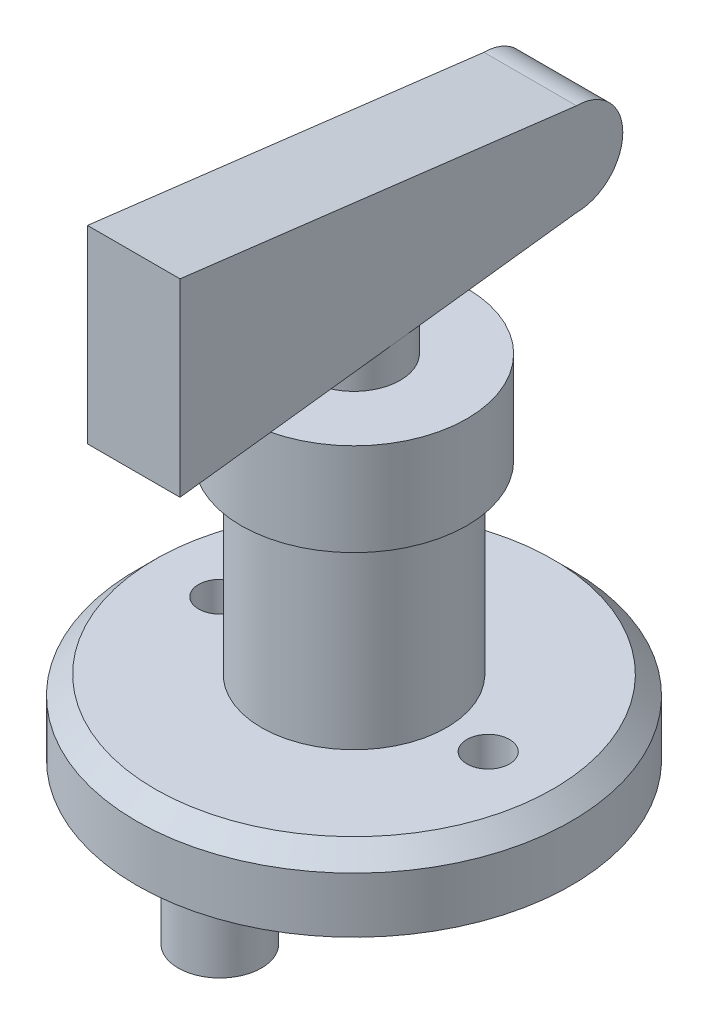
from build123d import *

# Parameters (mm, degrees)
SKETCH2_R           = 29.845
BOSS_EXTRUDE1_DEPTH = 10.16
SKETCH1_R           = 5.715
BOSS_EXTRUDE2_DEPTH = 12.7
SKETCH1_3_R         = 2.921
CUT_EXTRUDE1_DEPTH  = 12.7
SKETCH3_R           = 12.7
BOSS_EXTRUDE3_DEPTH = 25.4
CHAMFER1_SIZE       = 2.54
SKETCH4_R           = 15.494
BOSS_EXTRUDE4_DEPTH = 12.7
BOSS_EXTRUDE5_DEPTH = 6.35
BOSS_EXTRUDE6_REACH = 76.427
SKETCH5_R           = 6.35


with BuildPart() as part:
    # Sketch2 → Boss-Extrude1 (new body)
    with BuildSketch(Plane(origin=(0, 0, 0), x_dir=(1, 0, 0), z_dir=(0, 1, 0))):
        Circle(SKETCH2_R)
    extrude(amount=BOSS_EXTRUDE1_DEPTH)

    # Sketch1 → Boss-Extrude2 (add)
    with BuildSketch(Plane(origin=(0, 0, 0), x_dir=(1, 0, 0), z_dir=(0, 1, 0))):
        with Locations((0, 18.415)):
            Circle(SKETCH1_R)
        with Locations((0, -18.415)):
            Circle(SKETCH1_R)
    extrude(amount=-BOSS_EXTRUDE2_DEPTH)

    # Sketch1<3> → Cut-Extrude1 (cut)
    with BuildSketch(Plane(origin=(0, 0, 0), x_dir=(1, 0, 0), z_dir=(0, 1, 0))):
        with Locations((18.415, 0)):
            Circle(SKETCH1_3_R)
        with Locations((-18.415, 0)):
            Circle(SKETCH1_3_R)
    extrude(amount=CUT_EXTRUDE1_DEPTH, mode=Mode.SUBTRACT)

    # Sketch3 → Boss-Extrude3 (add)
    with BuildSketch(Plane(origin=(0, 10.16, 0), x_dir=(1, 0, 0), z_dir=(0, 1, 0))):
        Circle(SKETCH3_R)
    extrude(amount=BOSS_EXTRUDE3_DEPTH)

    # Chamfer1
    chamfer1_edges = [part.edges().sort_by_distance(p)[0] for p in [
        (-29.845, 10.16, 0),
    ]]
    chamfer(chamfer1_edges, length=CHAMFER1_SIZE)

    # Sketch4 → Boss-Extrude4 (add)
    with BuildSketch(Plane(origin=(0, 35.56, 0), x_dir=(1, 0, 0), z_dir=(0, 1, 0))):
        Circle(SKETCH4_R)
    extrude(amount=BOSS_EXTRUDE4_DEPTH)


with BuildPart() as body_2:
    # Sketch6 → Boss-Extrude5 (new, symmetric)
    with BuildSketch(Plane(origin=(0, 0, 0), x_dir=(0, 0, -1), z_dir=(1, 0, 0))):
        with BuildLine():
            Line((24.18628847, 68.802534381), (-30.225802667, 75.435358558))
            Line((-30.225802667, 75.435358558), (-30.225802667, 49.469710204))
            Line((-30.225802667, 49.469710204), (24.18628847, 56.102534381))
            ThreePointArc((24.18628847, 56.102534381), (30.53628847, 62.452534381), (24.18628847, 68.802534381))
        make_face()
    extrude(amount=BOSS_EXTRUDE5_DEPTH, both=True)


with BuildPart() as body_3:
    # Boss-Extrude6: up to this plane
    boss_extrude6_end = Plane(origin=(6.35, 49.469710204, 30.225802667), z_dir=(0, 0.9926520071358438, 0.1210041021171628))
    # Sketch5 → Boss-Extrude6 (new, up to the surface)
    with BuildSketch(Plane(origin=(0, 48.26, 0), x_dir=(1, 0, 0), z_dir=(0, 1, 0)), mode=Mode.PRIVATE) as boss_extrude6_sk1:
        Circle(SKETCH5_R)
    boss_extrude6_tool1 = split(extrude(boss_extrude6_sk1.sketch, amount=BOSS_EXTRUDE6_REACH, mode=Mode.PRIVATE), bisect_by=boss_extrude6_end, keep=Keep.BOTH, mode=Mode.PRIVATE)
    add(boss_extrude6_tool1.solids().sort_by_distance((0, 48.26, 0))[0])


with BuildPart() as body_2_1:
    add(body_2.part)

    # Combine1: union body 3
    add(body_3.part)


solid = Compound([part.part, body_2_1.part])
